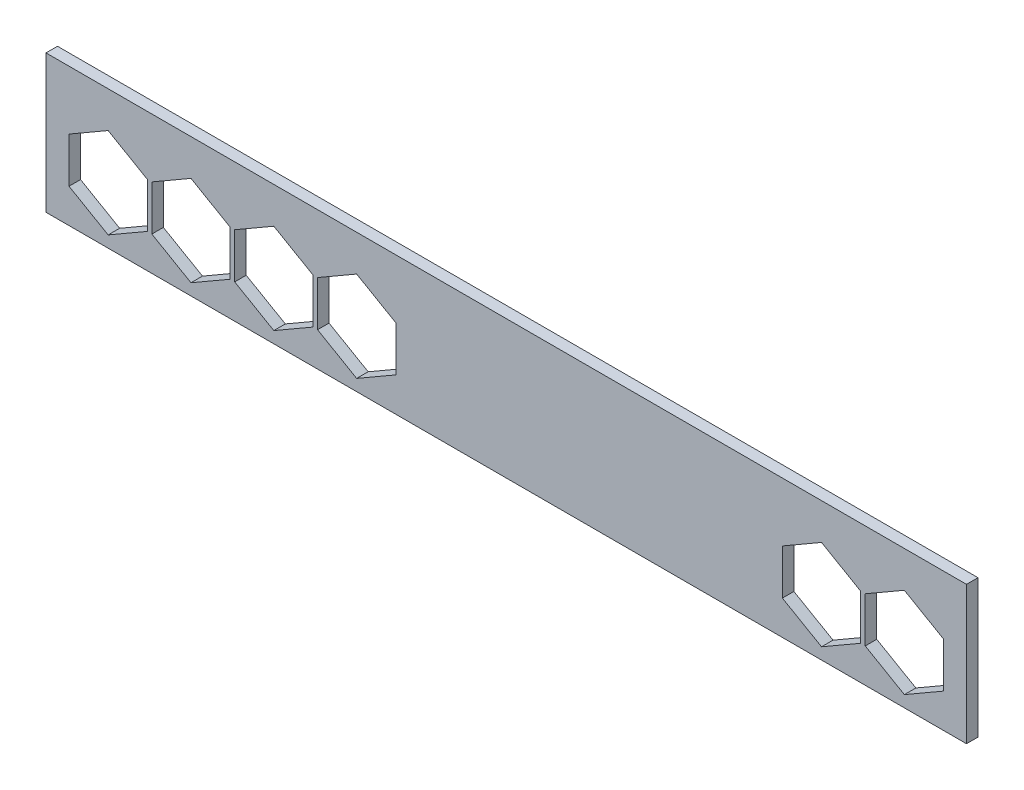
from build123d import *

# Parameters (mm, degrees)
SKETCH1_W           = 254
SKETCH1_H           = 38.1
BOSS_EXTRUDE1_DEPTH = 3.175
CUT_EXTRUDE1_DEPTH  = 10.414


with BuildPart() as part:
    # Sketch1 → Boss-Extrude1 (new body)
    with BuildSketch(Plane.XY):
        Rectangle(SKETCH1_W, SKETCH1_H)
    extrude(amount=BOSS_EXTRUDE1_DEPTH)

    # Sketch4 → Cut-Extrude1 (cut)
    with BuildSketch(Plane.XY.offset(3.175)):
        Polygon((-99.060120052, -9.6425385), (-99.060120052, 2.8223845), (-109.855060026, 9.054846), (-120.65, 2.8223845), (-120.65, -9.6425385), (-109.855060026, -15.875), align=None)
        Polygon((-76.200120052, -9.6425385), (-76.200120052, 2.8223845), (-86.995060026, 9.054846), (-97.79, 2.8223845), (-97.79, -9.6425385), (-86.995060026, -15.875), align=None)
        Polygon((-53.340120052, -9.6425385), (-53.340120052, 2.8223845), (-64.135060026, 9.054846), (-74.93, 2.8223845), (-74.93, -9.6425385), (-64.135060026, -15.875), align=None)
        Polygon((-30.480120052, -9.6425385), (-30.480120052, 2.8223845), (-41.275060026, 9.054846), (-52.07, 2.8223845), (-52.07, -9.6425385), (-41.275060026, -15.875), align=None)
        Polygon((120.65, -9.6425385), (120.65, 2.8223845), (109.855060026, 9.054846), (99.060120052, 2.8223845), (99.060120052, -9.6425385), (109.855060026, -15.875), align=None)
        Polygon((97.79, -9.6425385), (97.79, 2.8223845), (86.995060026, 9.054846), (76.200120052, 2.8223845), (76.200120052, -9.6425385), (86.995060026, -15.875), align=None)
    extrude(amount=-CUT_EXTRUDE1_DEPTH, mode=Mode.SUBTRACT)


solid = part.part
